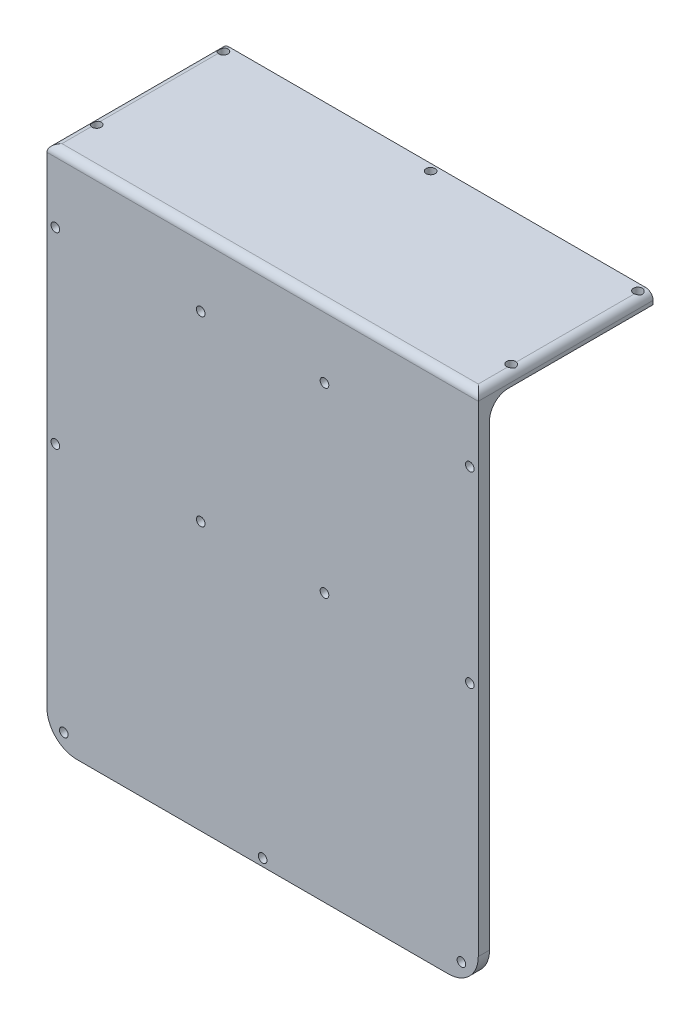
from build123d import *

# Parameters (mm, degrees)
BOSS_EXTRUDE3_DEPTH = 3
MOVE_FACE1_BY       = 5.4
SKETCH3_W           = 115
SKETCH3_H           = 46.6
BOSS_EXTRUDE4_DEPTH = 3
FILLET3_R           = 5
FILLET5_R           = 2
SKETCH4_R           = 1.15
CUT_EXTRUDE1_DEPTH  = 134.861204865
SKETCH5_R           = 1.2
CUT_EXTRUDE2_DEPTH  = 154.25224305
SKETCH6_R           = 1.15
CUT_EXTRUDE6_DEPTH  = 134.861205025


with BuildPart() as part:
    # Sketch1 → Boss-Extrude3 (new body)
    with BuildSketch(Plane.XY):
        with BuildLine():
            Line((-49.5, -25.454214411), (49.5, -25.454214411))
            ThreePointArc((49.5, -25.454214411), (55.156854249, -23.111068661), (57.5, -17.454214411))
            Line((57.5, -17.454214411), (57.5, 104.345785589))
            Line((57.5, 104.345785589), (-57.5, 104.345785589))
            Line((-57.5, 104.345785589), (-57.5, -17.454214411))
            ThreePointArc((-57.5, -17.454214411), (-55.156854249, -23.111068661), (-49.5, -25.454214411))
        make_face()
    extrude(amount=BOSS_EXTRUDE3_DEPTH)

    # Move Face1: a face moved outward by 5.4
    extrude(part.faces().sort_by_distance((0, 104.345785589, 1.5))[0], amount=MOVE_FACE1_BY, dir=(0, 1, 0))

    # Sketch3 → Boss-Extrude4 (add)
    with BuildSketch(Plane(origin=(0, 109.745785589, 0), x_dir=(1, 0, 0), z_dir=(0, 1, 0))):
        with Locations((0, 20.3)):
            Rectangle(SKETCH3_W, SKETCH3_H)
    extrude(amount=BOSS_EXTRUDE4_DEPTH)

    # Fillet3
    fillet3_edges = [part.edges().sort_by_distance(p)[0] for p in [
        (0, 109.745785589, 0),
    ]]
    fillet(fillet3_edges, radius=FILLET3_R)

    # Fillet5
    fillet5_edges = [part.edges().sort_by_distance(p)[0] for p in [
        (-57.5, 112.745785589, -20.3),
        (0, 112.745785589, 3),
        (57.5, 112.745785589, -20.3),
    ]]
    fillet(fillet5_edges, radius=FILLET5_R)

    # Sketch4 → Cut-Extrude1 (cut, through all)
    with BuildSketch(Plane(origin=(0, 0, 0), x_dir=(-1, 0, 0), z_dir=(0, 0, -1))):
        with Locations((-53, -20.954214411)):
            Circle(SKETCH4_R)
        with Locations((-55.25, 44.545785589)):
            Circle(SKETCH4_R)
        with Locations((-55.25, 94.545785589)):
            Circle(SKETCH4_R)
        with Locations((0, -23.454214411)):
            Circle(SKETCH4_R)
        with Locations((53, -20.954214411)):
            Circle(SKETCH4_R)
        with Locations((55.25, 44.545785589)):
            Circle(SKETCH4_R)
        with Locations((55.25, 94.545785589)):
            Circle(SKETCH4_R)
    extrude(amount=-CUT_EXTRUDE1_DEPTH, mode=Mode.SUBTRACT)

    # Sketch5 → Cut-Extrude2 (cut, through all)
    with BuildSketch(Plane.XZ.offset(-109.745785589)):
        with Locations(Location((55.25, -8, 0), (0, 0, 270))):
            Circle(SKETCH5_R)
        with Locations(Location((55.25, -41.8, 0), (0, 0, 270))):
            Circle(SKETCH5_R)
        with Locations(Location((0, -41.8, 0), (0, 0, 270))):
            Circle(SKETCH5_R)
        with Locations(Location((-55.25, -8, 0), (0, 0, 270))):
            Circle(SKETCH5_R)
        with Locations(Location((-55.25, -41.8, 0), (0, 0, 270))):
            Circle(SKETCH5_R)
    extrude(amount=-CUT_EXTRUDE2_DEPTH, mode=Mode.SUBTRACT)

    # Sketch6 → Cut-Extrude6 (cut, through all)
    with BuildSketch(Plane(origin=(0, 0, 0), x_dir=(-1, 0, 0), z_dir=(0, 0, -1))):
        with Locations((-16.5, 46)):
            Circle(SKETCH6_R)
        with Locations((16.5, 46)):
            Circle(SKETCH6_R)
        with Locations((16.5, 94.5)):
            Circle(SKETCH6_R)
        with Locations((-16.5, 94.5)):
            Circle(SKETCH6_R)
    extrude(amount=-CUT_EXTRUDE6_DEPTH, mode=Mode.SUBTRACT)


solid = part.part
